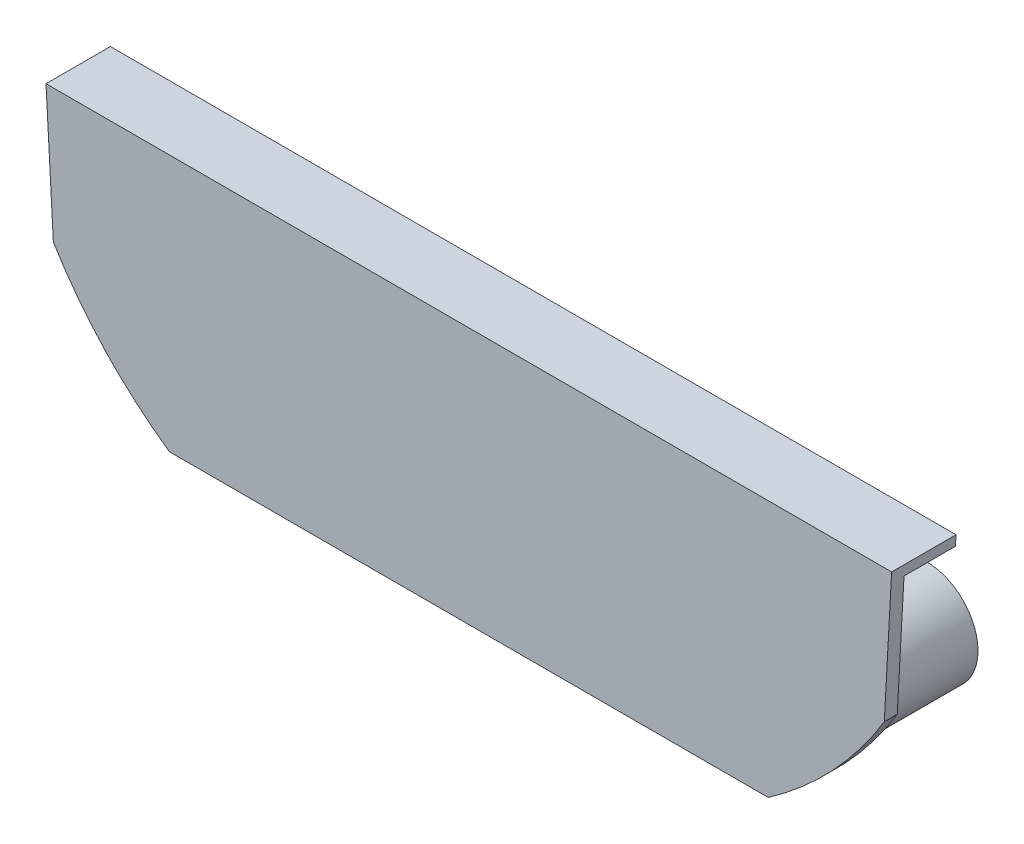
from build123d import *

# Parameters (mm, degrees)
RESSALTO_EXTRUS_O1_DEPTH = 1.26
ESBO_O2_R                = 5
RESSALTO_EXTRUS_O2_DEPTH = 11.26
RESSALTO_EXTRUS_O3_DEPTH = 5


with BuildPart() as part:
    # Esboço1 → Ressalto-extrusão1 (new body)
    with BuildSketch(Plane.XY):
        with BuildLine():
            Line((0, 0), (58.25, 0))
            ThreePointArc((58.25, 0), (64.518594138, 5.422084196), (69.535183289, 12.019667297))
            Line((69.535183289, 12.019667297), (70.25, 25))
            Line((70.25, 25), (-12, 25))
            Line((-12, 25), (-11.285183289, 12.019667297))
            ThreePointArc((-11.285183289, 12.019667297), (-6.268594138, 5.422084196), (0, 0))
        make_face()
    extrude(amount=RESSALTO_EXTRUS_O1_DEPTH)

    # Esboço2 → Ressalto-extrusão2 (add)
    with BuildSketch(Plane.XY.offset(1.26)):
        with Locations((-3.61, 11.3)):
            Circle(ESBO_O2_R)
        with Locations((62.39, 11.3)):
            Circle(ESBO_O2_R)
    extrude(amount=-RESSALTO_EXTRUS_O2_DEPTH)

    # Esboço3 → Ressalto-extrusão3 (add)
    with BuildSketch(Plane(origin=(0, 0, 0), x_dir=(-1, 0, 0), z_dir=(0, 0, -1))):
        Polygon((-70.25, 25), (12, 25), (11.944930787, 24), (-70.194930787, 24), align=None)
    extrude(amount=RESSALTO_EXTRUS_O3_DEPTH)


solid = part.part
